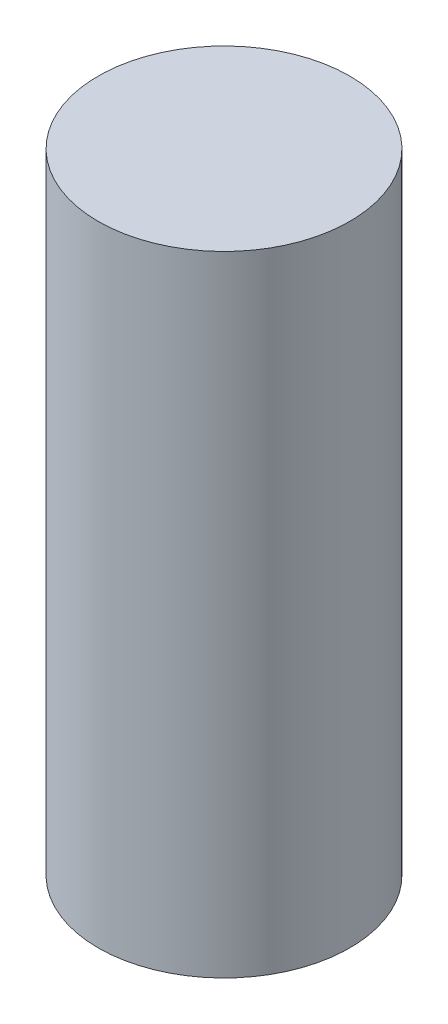
from build123d import *

# Parameters (mm, degrees)
SKETCH_1_R      = 300
EXTRUDE_1_DEPTH = 1500


with BuildPart() as part:
    # 草图1 → 凸台-拉伸1 (new body)
    with BuildSketch(Plane(origin=(0, 0, 0), x_dir=(1, 0, 0), z_dir=(0, 1, 0))):
        with Locations(Location((0, 0, 0), (0, 0, 270))):
            Circle(SKETCH_1_R)
    extrude(amount=EXTRUDE_1_DEPTH)


solid = part.part
